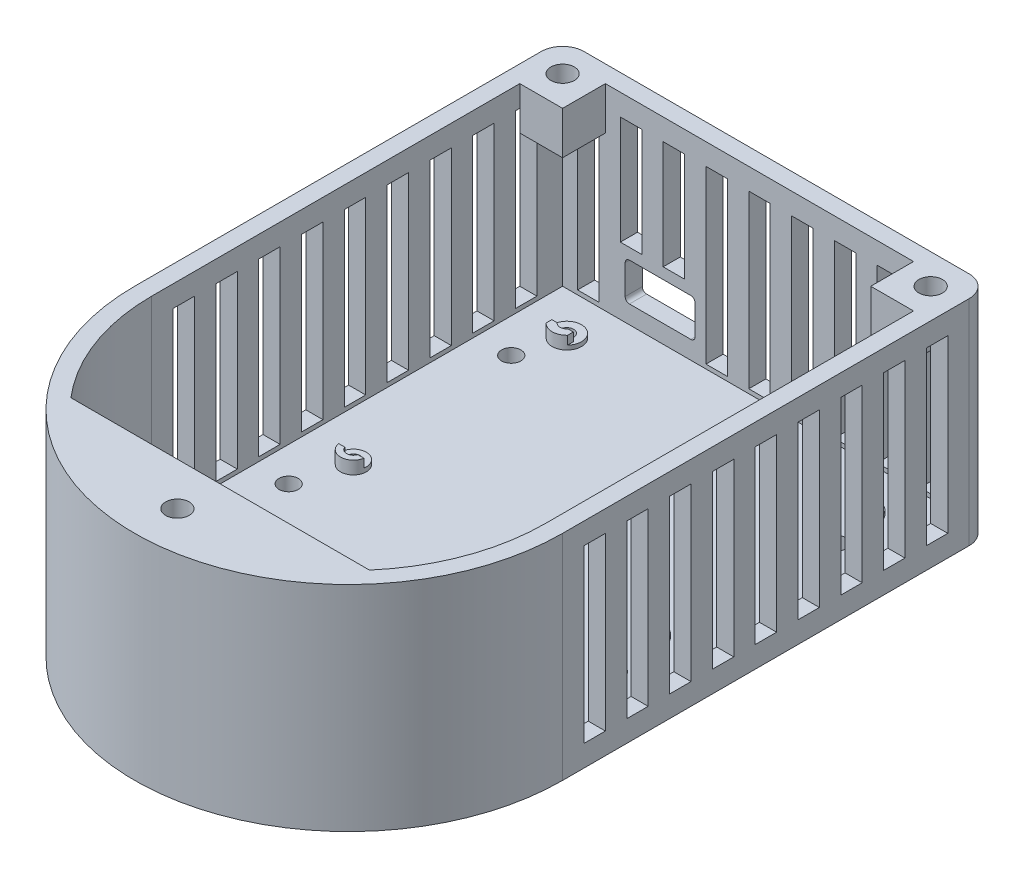
from build123d import *

# Parameters (mm, degrees)
EXTRUDE_1_DEPTH     = 50
SHELL_1_T           = -4
SKETCH_2_R          = 3
SKETCH_2_R_2        = 3.425496854
EXTRUDE_2_DEPTH     = 3
SKETCH_4_R          = 1.60000254
CUT_EXTRUDE_2_DEPTH = 4
SKETCH_7_R          = 2.25
CUT_EXTRUDE_4_DEPTH = 5
SKETCH_8_W          = 5
SKETCH_8_H          = 40
CUT_EXTRUDE_5_DEPTH = 144
SKETCH_9_W          = 5
SKETCH_9_H          = 40
CUT_EXTRUDE_6_DEPTH = 28
EXTRUDE_START       = -10
SKETCH_5_W          = 10
SKETCH_5_H          = 10
EXTRUDE_4_DEPTH     = 10
SKETCH_6_R          = 2.75
CUT_EXTRUDE_3_DEPTH = 4
FILLET_1_R          = 5
SKETCH_13_W         = 20.178165971
SKETCH_13_H         = 15.738969457
SKETCH_13_W_2       = 16.343899967
SKETCH_13_H_2       = 8.864106926
EXTRUDE_6_DEPTH     = 4
SKETCH_14_W         = 16.343899967
SKETCH_14_H         = 8.864106926
CUT_EXTRUDE_8_DEPTH = 10
FILLET_2_R          = 1


with BuildPart() as part:
    # 草图1 → 凸台-拉伸1 (new body)
    with BuildSketch(Plane(origin=(0, 0, 0), x_dir=(1, 0, 0), z_dir=(0, 1, 0))):
        with BuildLine():
            Line((-50, -50), (-50, 50))
            Line((-50, 50), (50, 50))
            Line((50, 50), (50, -50))
            ThreePointArc((50, -50), (0, -100), (-50, -50))
        make_face()
    extrude(amount=EXTRUDE_1_DEPTH)

    # 抽壳1
    shell_1_openings = [part.faces().sort_by_distance(p)[0] for p in [
        (0, 50, 20.082075005),
    ]]
    offset(amount=SHELL_1_T, openings=shell_1_openings, kind=Kind.INTERSECTION)

    # 草图2 → 凸台-拉伸2 (add)
    with BuildSketch(Plane(origin=(0, 4, 0), x_dir=(1, 0, 0), z_dir=(0, 1, 0))):
        with Locations(Location((35.632314962, -14.68949484, 0), (0, 0, 270))):
            Circle(SKETCH_2_R)
        with Locations(Location((35.760604874, 35.310439638, 0), (0, 0, 270))):
            Circle(SKETCH_2_R)
        with Locations(Location((-35, 36, 0), (0, 0, 270))):
            Circle(SKETCH_2_R_2)
        with Locations(Location((-34.367594322, -14.509888959, 0), (0, 0, 270))):
            Circle(SKETCH_2_R)
    extrude(amount=EXTRUDE_2_DEPTH)

    # 草图4 → 切除-拉伸2 (cut)
    with BuildSketch(Plane(origin=(0, 7, 0), x_dir=(1, 0, 0), z_dir=(0, 1, 0))):
        with Locations(Location((-34.367594322, -14.509888959, 0), (0, 0, 270))):
            Circle(SKETCH_4_R)
        with Locations(Location((-35, 36, 0), (0, 0, 270))):
            Circle(SKETCH_4_R)
        with Locations(Location((35.760604874, 35.310439638, 0), (0, 0, 270))):
            Circle(SKETCH_4_R)
        with Locations(Location((35.632314962, -14.68949484, 0), (0, 0, 270))):
            Circle(SKETCH_4_R)
    extrude(amount=-CUT_EXTRUDE_2_DEPTH, mode=Mode.SUBTRACT)

    # 草图7 → 切除-拉伸4 (cut)
    with BuildSketch(Plane(origin=(0, 4, 0), x_dir=(1, 0, 0), z_dir=(0, 1, 0))):
        with Locations(Location((-38, 26, 0), (0, 0, 270))):
            Circle(SKETCH_7_R)
        with Locations(Location((38, 26, 0), (0, 0, 270))):
            Circle(SKETCH_7_R)
        with Locations(Location((38, -26, 0), (0, 0, 270))):
            Circle(SKETCH_7_R)
        with Locations(Location((-38, -26, 0), (0, 0, 270))):
            Circle(SKETCH_7_R)
    extrude(amount=-CUT_EXTRUDE_4_DEPTH, mode=Mode.SUBTRACT)

    # 草图8 → 切除-拉伸5 (cut)
    with BuildSketch(Plane(origin=(50, 0, 0), x_dir=(0, 0, -1), z_dir=(1, 0, 0))):
        with Locations((-42.5, 25)):
            Rectangle(SKETCH_8_W, SKETCH_8_H)
        with Locations((-32.5, 25)):
            Rectangle(SKETCH_8_W, SKETCH_8_H)
        with Locations((-22.5, 25)):
            Rectangle(SKETCH_8_W, SKETCH_8_H)
        with Locations((-12.5, 25)):
            Rectangle(SKETCH_8_W, SKETCH_8_H)
        with Locations((-2.5, 25)):
            Rectangle(SKETCH_8_W, SKETCH_8_H)
        with Locations((7.5, 25)):
            Rectangle(SKETCH_8_W, SKETCH_8_H)
        with Locations((17.5, 25)):
            Rectangle(SKETCH_8_W, SKETCH_8_H)
        with Locations((27.5, 25)):
            Rectangle(SKETCH_8_W, SKETCH_8_H)
        with Locations((37.5, 25)):
            Rectangle(SKETCH_8_W, SKETCH_8_H)
    extrude(amount=-CUT_EXTRUDE_5_DEPTH, mode=Mode.SUBTRACT)

    # 草图9 → 切除-拉伸6 (cut)
    with BuildSketch(Plane(origin=(0, 0, -50), x_dir=(-1, 0, 0), z_dir=(0, 0, -1))):
        with Locations((0, 25)):
            Rectangle(SKETCH_9_W, SKETCH_9_H)
        with Locations((10, 25)):
            Rectangle(SKETCH_9_W, SKETCH_9_H)
        with Locations((20, 25)):
            Rectangle(SKETCH_9_W, SKETCH_9_H)
        with Locations((30, 25)):
            Rectangle(SKETCH_9_W, SKETCH_9_H)
        with Locations((40, 25)):
            Rectangle(SKETCH_9_W, SKETCH_9_H)
        with Locations((-10, 25)):
            Rectangle(SKETCH_9_W, SKETCH_9_H)
        with Locations((-20, 25)):
            Rectangle(SKETCH_9_W, SKETCH_9_H)
        with Locations((-30, 25)):
            Rectangle(SKETCH_9_W, SKETCH_9_H)
        with Locations((-40, 25)):
            Rectangle(SKETCH_9_W, SKETCH_9_H)
    extrude(amount=-CUT_EXTRUDE_6_DEPTH, mode=Mode.SUBTRACT)

    # 草图5 → 凸台-拉伸4 (add)
    with BuildSketch(Plane(origin=(0, 50, 0), x_dir=(1, 0, 0), z_dir=(0, 1, 0)).offset(EXTRUDE_START)):
        with Locations((-41, 41)):
            Rectangle(SKETCH_5_W, SKETCH_5_H)
        with Locations((41, 41)):
            Rectangle(SKETCH_5_W, SKETCH_5_H)
        with BuildLine():
            Line((34.871191548, -80), (-34.871191548, -80))
            ThreePointArc((-34.871191548, -80), (0, -96), (34.871191548, -80))
        make_face()
    extrude(amount=EXTRUDE_4_DEPTH)

    # 草图6 → 切除-拉伸3 (cut)
    with BuildSketch(Plane(origin=(0, 50, 0), x_dir=(1, 0, 0), z_dir=(0, 1, 0))):
        with Locations(Location((43, 43, 0), (0, 0, 270))):
            Circle(SKETCH_6_R)
        with Locations(Location((0, -90, 0), (0, 0, 270))):
            Circle(SKETCH_6_R)
        with Locations(Location((-43, 43, 0), (0, 0, 90))):
            Circle(SKETCH_6_R)
    extrude(amount=-CUT_EXTRUDE_3_DEPTH, mode=Mode.SUBTRACT)

    # 圆角1
    fillet_1_edges = [part.edges().sort_by_distance(p)[0] for p in [
        (-50, 25, -50),
        (50, 25, -50),
    ]]
    fillet(fillet_1_edges, radius=FILLET_1_R)

    # 草图13 → 凸台-拉伸6 (add)
    with BuildSketch(Plane(origin=(0, 0, -50), x_dir=(-1, 0, 0), z_dir=(0, 0, -1))):
        with Locations((24.507779854, 11.808957997)):
            Rectangle(SKETCH_13_W, SKETCH_13_H)
        with Locations((23.205413146, 12.661389703)):
            Rectangle(SKETCH_13_W_2, SKETCH_13_H_2, mode=Mode.SUBTRACT)
    extrude(amount=-EXTRUDE_6_DEPTH)

    # 草图14 → 切除-拉伸8 (cut)
    with BuildSketch(Plane(origin=(0, 0, -50), x_dir=(-1, 0, 0), z_dir=(0, 0, -1))):
        with Locations((23.205413146, 12.661389703)):
            Rectangle(SKETCH_14_W, SKETCH_14_H)
    extrude(amount=-CUT_EXTRUDE_8_DEPTH, mode=Mode.SUBTRACT)

    # 圆角2
    fillet_2_edges = [part.edges().sort_by_distance(p)[0] for p in [
        (-31.37736313, 17.093443166, -48),
        (-31.37736313, 8.22933624, -48),
        (-15.033463163, 17.093443166, -48),
        (-15.033463163, 8.22933624, -48),
    ]]
    fillet(fillet_2_edges, radius=FILLET_2_R)


solid = part.part
